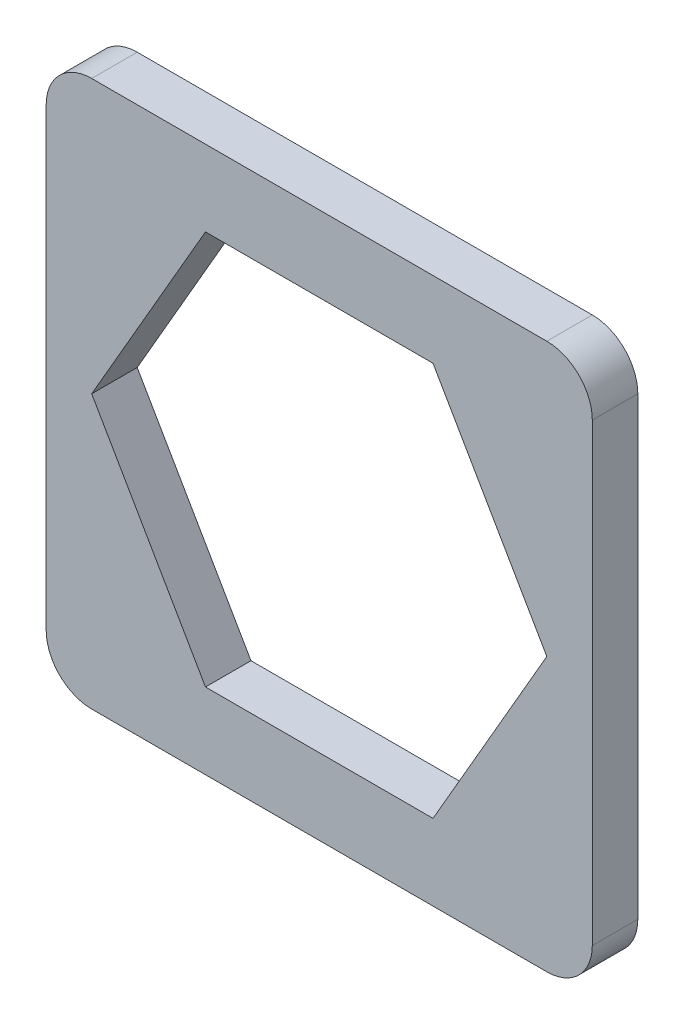
from build123d import *

# Parameters (mm, degrees)
BOSS_EXTRUDE1_DEPTH = 10
CUT_EXTRUDE3_DEPTH  = 10


with BuildPart() as part:
    # Sketch1 → Boss-Extrude1 (new body)
    with BuildSketch(Plane.XY):
        with BuildLine():
            Line((-50, 60), (50, 60))
            ThreePointArc((50, 60), (57.071067812, 57.071067812), (60, 50))
            Line((60, 50), (60, -50))
            ThreePointArc((60, -50), (57.071067812, -57.071067812), (50, -60))
            Line((50, -60), (-50, -60))
            ThreePointArc((-50, -60), (-57.071067812, -57.071067812), (-60, -50))
            Line((-60, -50), (-60, 50))
            ThreePointArc((-60, 50), (-57.071067812, 57.071067812), (-50, 60))
        make_face()
    extrude(amount=BOSS_EXTRUDE1_DEPTH)

    # Sketch3 → Cut-Extrude3 (cut)
    with BuildSketch(Plane.XY.offset(10)):
        Polygon((25, -43.301270189), (50, 0), (25, 43.301270189), (-25, 43.301270189), (-50, 0), (-25, -43.301270189), align=None)
    extrude(amount=-CUT_EXTRUDE3_DEPTH, mode=Mode.SUBTRACT)


solid = part.part
